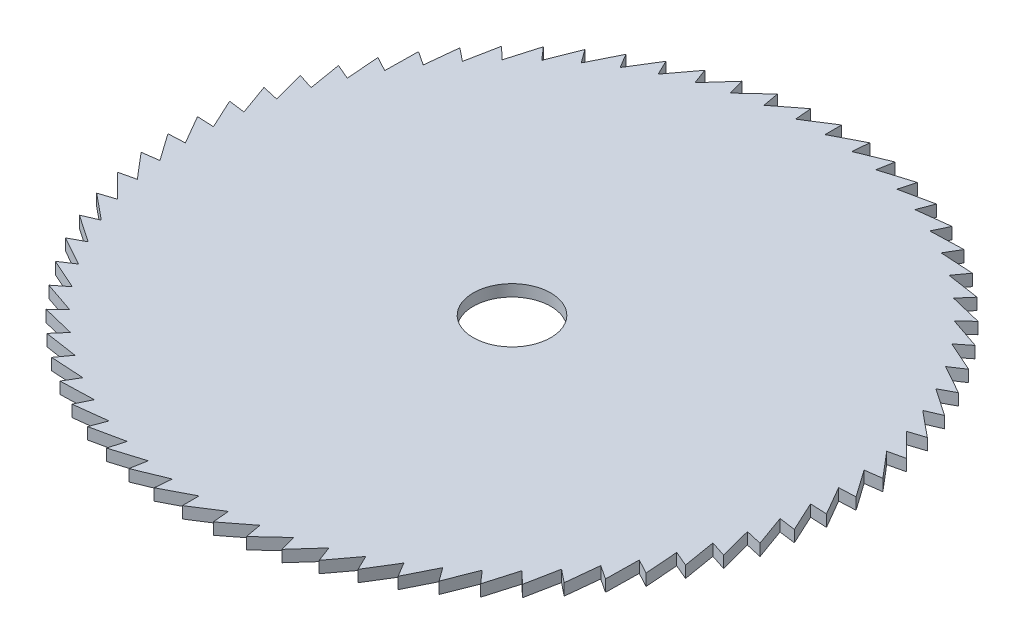
from build123d import *

# Parameters (mm, degrees)
SKETCH_1_R               = 25.5
SKETCH_1_R_2             = 3
EXTRUDE_1_DEPTH          = 0.9
CUT_EXTRUDE_2_DEPTH      = 0.9
PATTERN_CIRCULAR_1_COUNT = 70


with BuildPart() as part:
    # 스케치1 → 보스-돌출1 (new body)
    with BuildSketch(Plane(origin=(0, 0, 0), x_dir=(1, 0, 0), z_dir=(0, 1, 0))):
        with Locations(Location((0, 0, 0), (0, 0, 270))):
            Circle(SKETCH_1_R)
        with Locations(Location((0, 0, 0), (0, 0, 270))):
            Circle(SKETCH_1_R_2, mode=Mode.SUBTRACT)
    extrude(amount=EXTRUDE_1_DEPTH)

    # 스케치3 → 컷-돌출2 (cut)
    with BuildSketch(Plane(origin=(0, 0.9, 0), x_dir=(1, 0, 0), z_dir=(0, 1, 0))):
        Polygon((0, 25.5), (0, 24.2), (3.797752252, 26.174934679), (0, 26.174934679), align=None)
    cut_extrude_2 = extrude(amount=-CUT_EXTRUDE_2_DEPTH, mode=Mode.SUBTRACT)

    # 원형 패턴1: 컷-돌출2 ×70 about axis
    pattern_circular_1_axis = Axis((0, 0, 0), (0, 1, 0))
    for i in range(1, PATTERN_CIRCULAR_1_COUNT):
        add(cut_extrude_2.rotate(pattern_circular_1_axis, i * 360 / PATTERN_CIRCULAR_1_COUNT), mode=Mode.SUBTRACT)


solid = part.part
